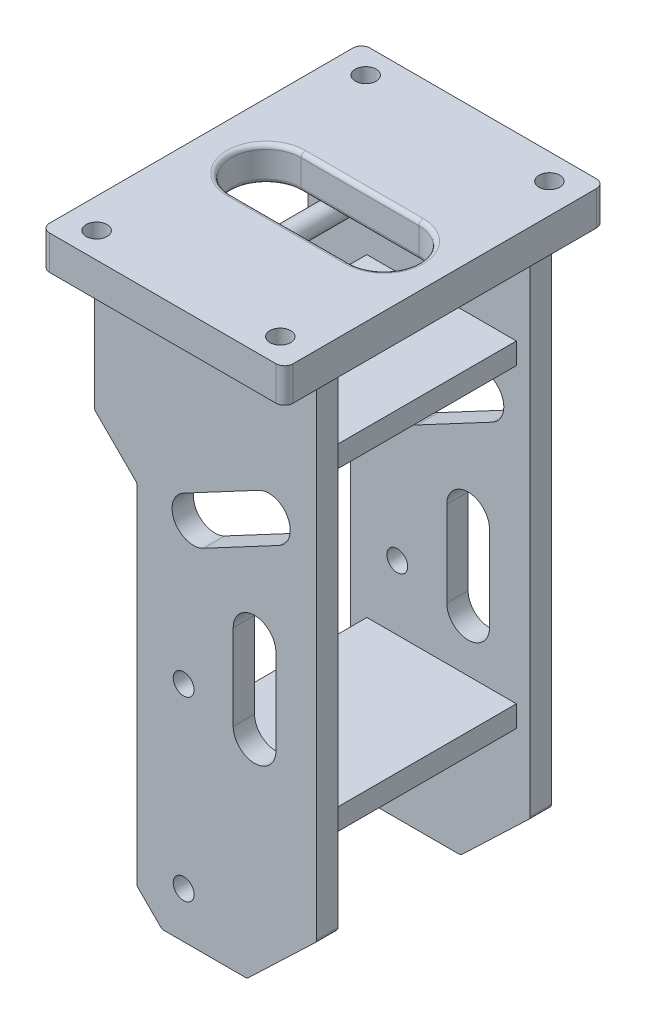
from build123d import *

# Parameters (mm, degrees)
SKETCH_1_R                  = 2.44
EXTRUDE_1_DEPTH             = 5
SKETCH_2_W                  = 57
SKETCH_2_H                  = 75
EXTRUDE_2_DEPTH             = 8
FILLET_2_R                  = 2
SKETCH_5_R                  = 2.44
CUT_EXTRUDE_1_DEPTH         = 8
CUT_EXTRUDE_2_DEPTH         = 8
EXTRUDE_3_REACH             = 120.642
SKETCH_8_W                  = 35
SKETCH_8_H                  = 5
EXTRUDE_5_REACH             = 120.642
SKETCH_11_R                 = 2.44
EXTRUDE_5_DIRECTION_2_DEPTH = 1
FILLET_3_R                  = 1
FILLET_4_R                  = 1
FILLET_5_R                  = 1


with BuildPart() as part:
    # 草图1 → 凸台-拉伸1 (new body)
    with BuildSketch(Plane.XY):
        Polygon((-46.310951177, 81.963538879), (5.689048823, 81.963538879), (5.689048823, -32.497144245), (-10.581530023, -48.036461121), (-30.494941882, -48.036461121), (-36.358514487, -42.186365356), (-36.358514487, 39.484909248), (-46.310951177, 49.414471249), align=None)
        with Locations((-25.431583751, 4.238597292)):
            Circle(SKETCH_1_R, mode=Mode.SUBTRACT)
        with Locations((-25.431583751, -37.250347054)):
            Circle(SKETCH_1_R, mode=Mode.SUBTRACT)
        with BuildLine():
            Line((-3.836664977, 21.439836348), (-3.836664977, 1.439836348))
            ThreePointArc((-3.836664977, 1.439836348), (-8.836664977, -3.560163652), (-13.836664977, 1.439836348))
            Line((-13.836664977, 1.439836348), (-13.836664977, 21.439836348))
            ThreePointArc((-13.836664977, 21.439836348), (-8.836664977, 26.439836348), (-3.836664977, 21.439836348))
        make_face(mode=Mode.SUBTRACT)
        with BuildLine():
            Line((-25.487672716, 42.887410274), (-7.833082179, 52.28503939))
            ThreePointArc((-7.833082179, 52.28503939), (-1.070027266, 50.220799035), (-3.134267621, 43.457744122))
            Line((-3.134267621, 43.457744122), (-20.788858158, 34.060115006))
            ThreePointArc((-20.788858158, 34.060115006), (-27.551913071, 36.124355361), (-25.487672716, 42.887410274))
        make_face(mode=Mode.SUBTRACT)
    extrude(amount=EXTRUDE_1_DEPTH)


with BuildPart() as body_2:
    # 草图2 → 凸台-拉伸2 (new body)
    with BuildSketch(Plane(origin=(0, 81.963538879, 0), x_dir=(1, 0, 0), z_dir=(0, 1, 0))):
        with Locations((-20.310951177, 22.5)):
            Rectangle(SKETCH_2_W, SKETCH_2_H)
    extrude(amount=EXTRUDE_2_DEPTH)

    # 圆角2
    fillet_2_edges = [body_2.edges().sort_by_distance(p)[0] for p in [
        (8.189048823, 85.963538879, 15),
        (-48.810951177, 85.963538879, 15),
        (-48.810951177, 85.963538879, -60),
        (8.189048823, 85.963538879, -60),
    ]]
    fillet(fillet_2_edges, radius=FILLET_2_R)

    # 草图5 → 切除-拉伸1 (cut)
    with BuildSketch(Plane(origin=(0, 89.963538879, 0), x_dir=(1, 0, 0), z_dir=(0, 1, 0))):
        with Locations(Location((-41.810951177, 54, 0), (0, 0, 270))):
            Circle(SKETCH_5_R)
        with Locations(Location((1.189048823, 54, 0), (0, 0, 270))):
            Circle(SKETCH_5_R)
        with Locations(Location((-41.810951177, -9, 0), (0, 0, 270))):
            Circle(SKETCH_5_R)
        with Locations(Location((1.189048823, -9, 0), (0, 0, 270))):
            Circle(SKETCH_5_R)
    extrude(amount=-CUT_EXTRUDE_1_DEPTH, mode=Mode.SUBTRACT)

    # 草图6 → 切除-拉伸2 (cut)
    with BuildSketch(Plane(origin=(0, 89.963538879, 0), x_dir=(1, 0, 0), z_dir=(0, 1, 0))):
        with BuildLine():
            Line((-33.612494658, 30.680093585), (-6.013570216, 30.680093585))
            ThreePointArc((-6.013570216, 30.680093585), (2.166523369, 22.5), (-6.013570216, 14.319906415))
            Line((-6.013570216, 14.319906415), (-33.612494658, 14.319906415))
            ThreePointArc((-33.612494658, 14.319906415), (-41.792588242, 22.5), (-33.612494658, 30.680093585))
        make_face()
    extrude(amount=-CUT_EXTRUDE_2_DEPTH, mode=Mode.SUBTRACT)

    # 圆角3
    fillet_3_edges = [body_2.edges().sort_by_distance(p)[0] for p in [
        (-41.792588242, 81.963538879, -22.5),
        (-19.813032437, 81.963538879, -30.680093585),
        (2.166523369, 81.963538879, -22.5),
        (-19.813032437, 81.963538879, -14.319906415),
        (-41.792588242, 89.963538879, -22.5),
        (-19.813032437, 89.963538879, -14.319906415),
        (2.166523369, 89.963538879, -22.5),
        (-19.813032437, 89.963538879, -30.680093585),
    ]]
    fillet(fillet_3_edges, radius=FILLET_3_R)


with BuildPart() as body_3:
    # 镜向2: mirrored copy
    add(part.part.mirror(Plane.XY.offset(-22.5)))


with BuildPart() as body_4:

    # 草图8 → 凸台-拉伸3 (new, up to next)
    with BuildSketch(Plane(origin=(0, 0, 0), x_dir=(-1, 0, 0), z_dir=(0, 0, -1)), mode=Mode.PRIVATE) as extrude_3_sk1:
        with Locations((15.037570637, 60.214736535)):
            Rectangle(SKETCH_8_W, SKETCH_8_H)
    extrude_3_tool1 = extrude(extrude_3_sk1.sketch, amount=EXTRUDE_3_REACH, mode=Mode.PRIVATE) - body_3.part
    # 草图8 → 凸台-拉伸3 (new, up to next)
    with BuildSketch(Plane(origin=(0, 0, 0), x_dir=(-1, 0, 0), z_dir=(0, 0, -1)), mode=Mode.PRIVATE) as extrude_3_sk2:
        with Locations((15.037570637, -13.340664977)):
            Rectangle(SKETCH_8_W, SKETCH_8_H)
    extrude_3_tool2 = extrude(extrude_3_sk2.sketch, amount=EXTRUDE_3_REACH, mode=Mode.PRIVATE) - body_3.part
    add(extrude_3_tool1.solids().sort_by_distance((-15.037571, 60.214737, 0))[0])
    add(extrude_3_tool2.solids().sort_by_distance((-15.037571, -13.340665, 0))[0])


with BuildPart() as body_5:

    # 草图11 → 凸台-拉伸5 (new, up to next)
    with BuildSketch(Plane(origin=(0, 0, 0), x_dir=(-1, 0, 0), z_dir=(0, 0, -1)), mode=Mode.PRIVATE) as extrude_5_sk1:
        with Locations((36.310951177, 71.963538879)):
            Circle(SKETCH_11_R)
    extrude_5_tool1 = extrude(extrude_5_sk1.sketch, amount=EXTRUDE_5_REACH, mode=Mode.PRIVATE) - body_3.part
    add(extrude_5_tool1.solids().sort_by_distance((-36.310951, 71.963539, 0))[0])

    # 草图11 → 凸台-拉伸5 direction 2 (add)
    with BuildSketch(Plane(origin=(0, 0, 0), x_dir=(-1, 0, 0), z_dir=(0, 0, -1))):
        with Locations((36.310951177, 71.963538879)):
            Circle(SKETCH_11_R)
    extrude(amount=-EXTRUDE_5_DIRECTION_2_DEPTH)


with BuildPart() as body_3_1:
    add(body_3.part)

    # 圆角4
    fillet_4_edges = [body_3_1.edges().sort_by_distance(p)[0] for p in [
        (-46.310951177, 81.963538879, -47.5),
        (5.689048823, 81.963538879, -47.5),
        (5.689048823, -32.497144245, -47.5),
        (-10.581530023, -48.036461121, -47.5),
        (-30.494941882, -48.036461121, -47.5),
        (-36.358514487, -42.186365356, -47.5),
        (-36.358514487, 39.484909248, -47.5),
        (-46.310951177, 49.414471249, -47.5),
    ]]
    fillet(fillet_4_edges, radius=FILLET_4_R)


with BuildPart() as part_1:
    add(part.part)

    # 圆角5
    fillet_5_edges = [part_1.edges().sort_by_distance(p)[0] for p in [
        (-46.310951177, 81.963538879, 2.5),
        (5.689048823, 81.963538879, 2.5),
        (5.689048823, -32.497144245, 2.5),
        (-10.581530023, -48.036461121, 2.5),
        (-30.494941882, -48.036461121, 2.5),
        (-36.358514487, -42.186365356, 2.5),
        (-36.358514487, 39.484909248, 2.5),
        (-46.310951177, 49.414471249, 2.5),
    ]]
    fillet(fillet_5_edges, radius=FILLET_5_R)


solid = Compound([body_2.part, body_4.part, body_5.part, body_3_1.part, part_1.part])
